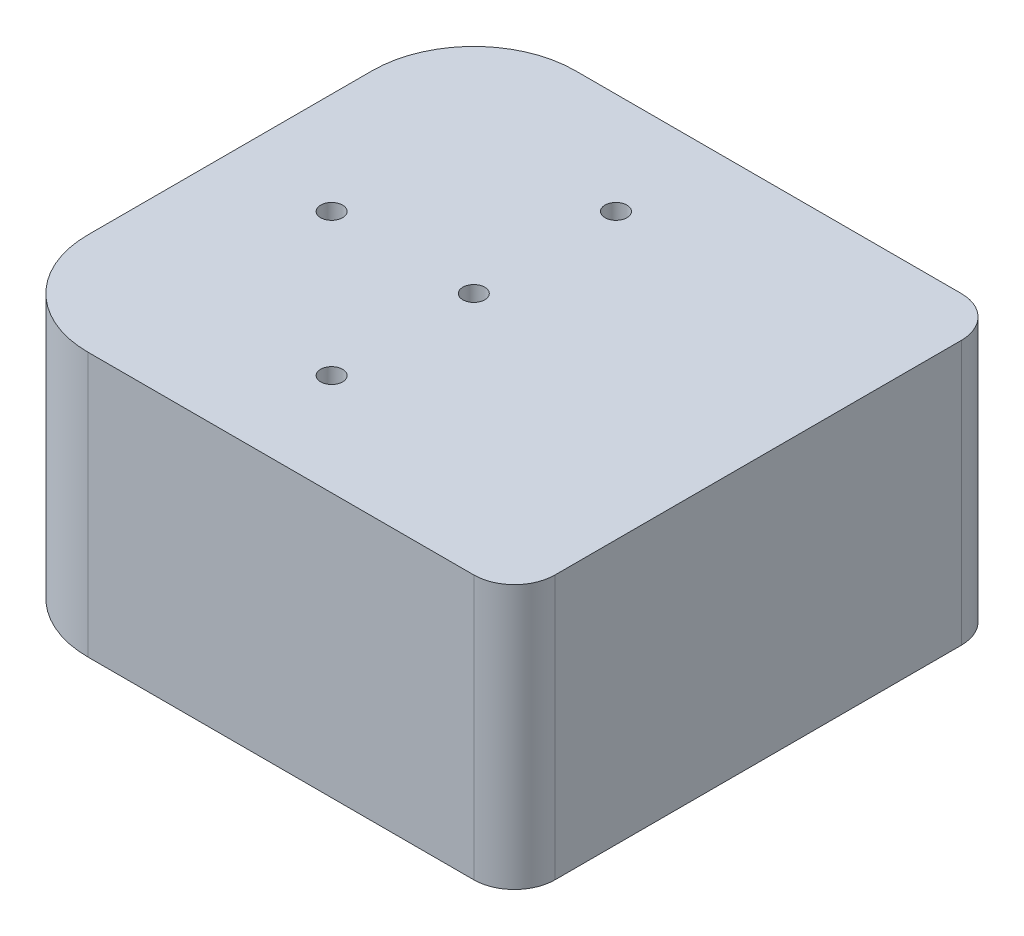
from build123d import *

# Parameters (mm, degrees)
SKETCH1_R           = 0.54
BOSS_EXTRUDE1_DEPTH = 13


with BuildPart() as part:
    # Sketch1 → Boss-Extrude1 (new body)
    with BuildSketch(Plane(origin=(0, 0, 0), x_dir=(1, 0, 0), z_dir=(0, 1, 0))):
        with BuildLine():
            Line((-7, 12), (12, 12))
            ThreePointArc((12, 12), (13.414213562, 11.414213562), (14, 10))
            Line((14, 10), (14, -10))
            ThreePointArc((14, -10), (13.414213562, -11.414213562), (12, -12))
            Line((12, -12), (-7, -12))
            ThreePointArc((-7, -12), (-10.535533906, -10.535533906), (-12, -7))
            Line((-12, -7), (-12, 7))
            ThreePointArc((-12, 7), (-10.535533906, 10.535533906), (-7, 12))
        make_face()
        with Locations(Location((0, 0, 0), (0, 0, 270))):
            Circle(SKETCH1_R, mode=Mode.SUBTRACT)
        with Locations(Location((-7, 0, 0), (0, 0, 270))):
            Circle(SKETCH1_R, mode=Mode.SUBTRACT)
        with Locations(Location((0, 7, 0), (0, 0, 270))):
            Circle(SKETCH1_R, mode=Mode.SUBTRACT)
        with Locations(Location((0, -7, 0), (0, 0, 270))):
            Circle(SKETCH1_R, mode=Mode.SUBTRACT)
    extrude(amount=BOSS_EXTRUDE1_DEPTH)


solid = part.part
